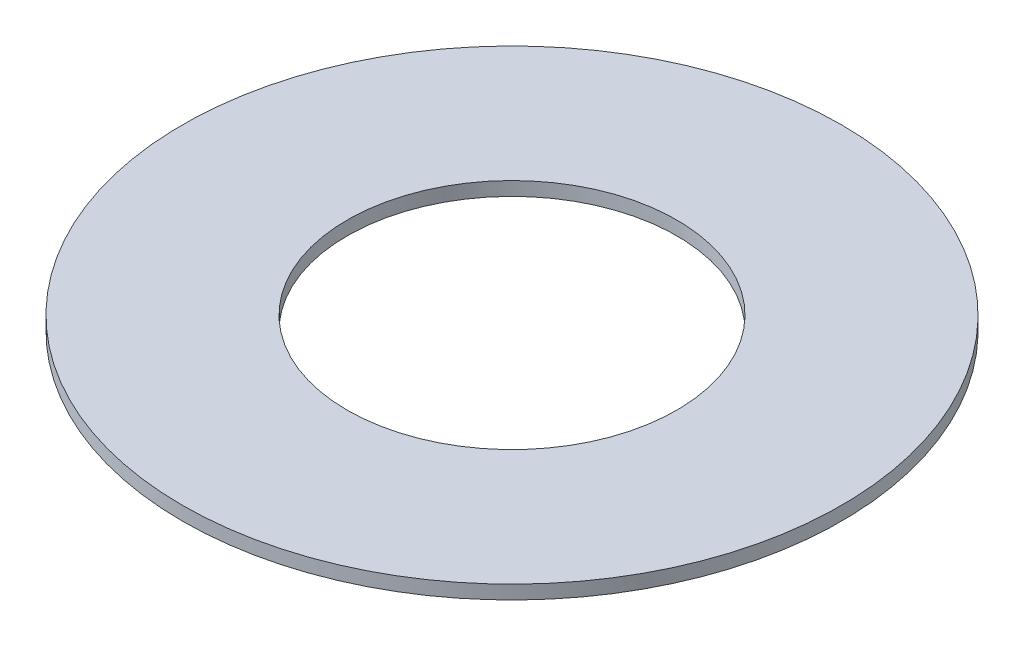
from build123d import *

# Parameters (mm, degrees)
SKETCH1_R           = 10.3124
SKETCH1_R_2         = 5.1562
BOSS_EXTRUDE1_DEPTH = 0.43


with BuildPart() as part:
    # Sketch1 → Boss-Extrude1 (new body)
    with BuildSketch(Plane(origin=(0, 0, 0), x_dir=(1, 0, 0), z_dir=(0, 1, 0))):
        with Locations(Location((0, 0, 0), (0, 0, 270))):
            Circle(SKETCH1_R)
        with Locations(Location((0, 0, 0), (0, 0, 270))):
            Circle(SKETCH1_R_2, mode=Mode.SUBTRACT)
    extrude(amount=BOSS_EXTRUDE1_DEPTH)


solid = part.part
